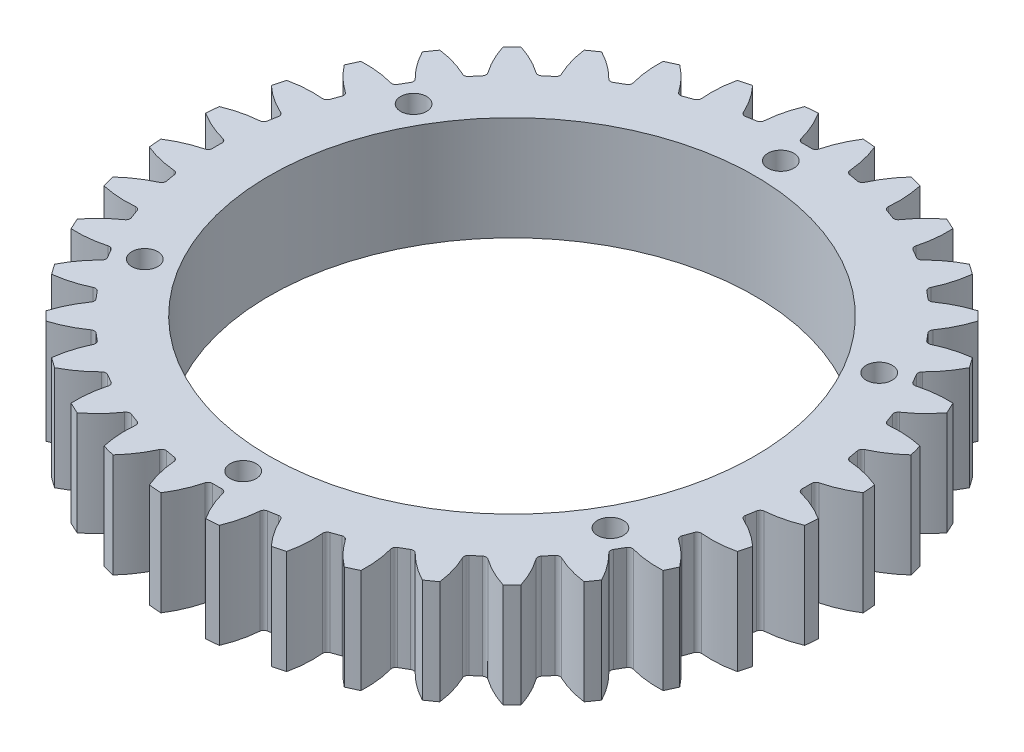
from build123d import *

# Parameters (mm, degrees)
SKETCH_1_R               = 38
SKETCH_1_R_2             = 28
SKETCH_1_R_3             = 1.5
EXTRUDE_1_DEPTH          = 12
CUT_EXTRUDE_1_DEPTH      = 56.063599592
PATTERN_CIRCULAR_1_COUNT = 36


with BuildPart() as part:
    # 草图1 → 凸台-拉伸1 (new body)
    with BuildSketch(Plane(origin=(0, 0, 0), x_dir=(1, 0, 0), z_dir=(0, 1, 0))):
        with Locations(Location((0, 0, 0), (0, 0, 270))):
            Circle(SKETCH_1_R)
        with Locations(Location((0, 0, 0), (0, 0, 270))):
            Circle(SKETCH_1_R_2, mode=Mode.SUBTRACT)
        with Locations(Location((0, 31, 0), (0, 0, 270))):
            Circle(SKETCH_1_R_3, mode=Mode.SUBTRACT)
        with Locations(Location((26.846787517, 15.5, 0), (0, 0, 270))):
            Circle(SKETCH_1_R_3, mode=Mode.SUBTRACT)
        with Locations(Location((26.846787517, -15.5, 0), (0, 0, 270))):
            Circle(SKETCH_1_R_3, mode=Mode.SUBTRACT)
        with Locations(Location((0, -31, 0), (0, 0, 270))):
            Circle(SKETCH_1_R_3, mode=Mode.SUBTRACT)
        with Locations(Location((-26.846787517, -15.5, 0), (0, 0, 270))):
            Circle(SKETCH_1_R_3, mode=Mode.SUBTRACT)
        with Locations(Location((-26.846787517, 15.5, 0), (0, 0, 270))):
            Circle(SKETCH_1_R_3, mode=Mode.SUBTRACT)
    extrude(amount=EXTRUDE_1_DEPTH)

    # 草图2 → 切除-拉伸1 (cut, through all)
    with BuildSketch(Plane(origin=(0, 0, 0), x_dir=(1, 0, 0), z_dir=(0, 1, 0))):
        with BuildLine():
            ThreePointArc((2.588370465, 37.911744069), (0, 38), (-2.588370465, 37.911744069))
            ThreePointArc((-2.588370465, 37.911744069), (-1.671005464, 36.20187222), (-1.03366082, 34.369111437))
            ThreePointArc((-1.03366082, 34.369111437), (-0.852336111, 34.097433433), (-0.541959095, 33.995680319))
            ThreePointArc((-0.541959095, 33.995680319), (0, 34), (0.541959095, 33.995680319))
            ThreePointArc((0.541959095, 33.995680319), (0.852336111, 34.097433433), (1.03366082, 34.369111437))
            ThreePointArc((1.03366082, 34.369111437), (1.671005464, 36.20187222), (2.588370465, 37.911744069))
        make_face()
    cut_extrude_1 = extrude(amount=CUT_EXTRUDE_1_DEPTH, mode=Mode.SUBTRACT)

    # 阵列(圆周)1: 切除-拉伸1 ×36 about axis
    pattern_circular_1_axis = Axis((0, 0, 0), (0, 1, 0))
    for i in range(1, PATTERN_CIRCULAR_1_COUNT):
        add(cut_extrude_1.rotate(pattern_circular_1_axis, i * 360 / PATTERN_CIRCULAR_1_COUNT), mode=Mode.SUBTRACT)


solid = part.part
